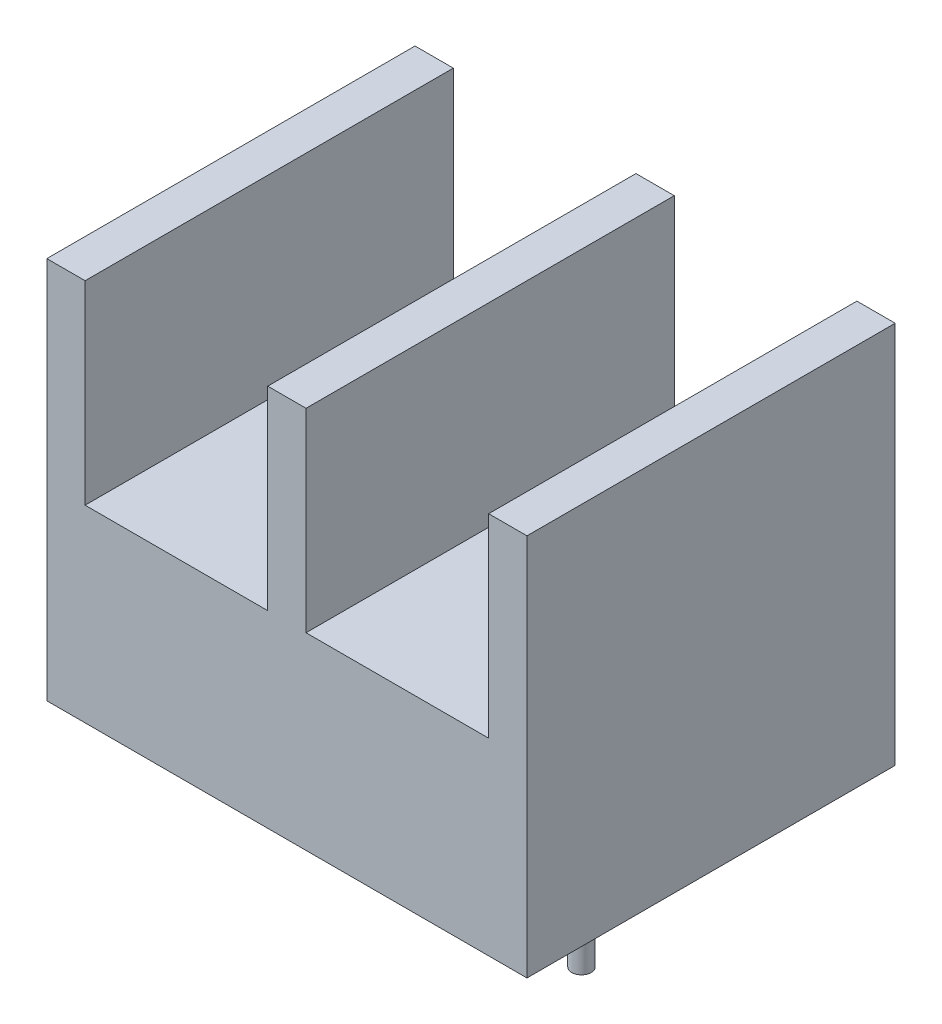
from build123d import *

# Parameters (mm, degrees)
SKETCH1_W           = 20.701
SKETCH1_H           = 15.875
BOSS_EXTRUDE1_DEPTH = 16.51
SKETCH2_R           = 0.4191
BOSS_EXTRUDE2_DEPTH = 6.35
SKETCH3_W           = 7.874
SKETCH3_H           = 8.382
CUT_EXTRUDE1_DEPTH  = 26.134211252


with BuildPart() as part:
    # Sketch1 → Boss-Extrude1 (new body)
    with BuildSketch(Plane(origin=(0, 0, 0), x_dir=(1, 0, 0), z_dir=(0, 1, 0))):
        Rectangle(SKETCH1_W, SKETCH1_H)
    extrude(amount=BOSS_EXTRUDE1_DEPTH)

    # Sketch2 → Boss-Extrude2 (add)
    with BuildSketch(Plane(origin=(0, 0, 0), x_dir=(-1, 0, 0), z_dir=(0, -1, 0))):
        with Locations((4.7625, 0)):
            Circle(SKETCH2_R)
        with Locations((-4.7625, 0)):
            Circle(SKETCH2_R)
    extrude(amount=BOSS_EXTRUDE2_DEPTH)

    # Sketch3 → Cut-Extrude1 (cut, through all)
    with BuildSketch(Plane(origin=(0, 0, -7.9375), x_dir=(-1, 0, 0), z_dir=(0, 0, -1))):
        with Locations((-4.7625, 12.319)):
            Rectangle(SKETCH3_W, SKETCH3_H)
        with Locations((4.7625, 12.319)):
            Rectangle(SKETCH3_W, SKETCH3_H)
    extrude(amount=-CUT_EXTRUDE1_DEPTH, mode=Mode.SUBTRACT)


solid = part.part
